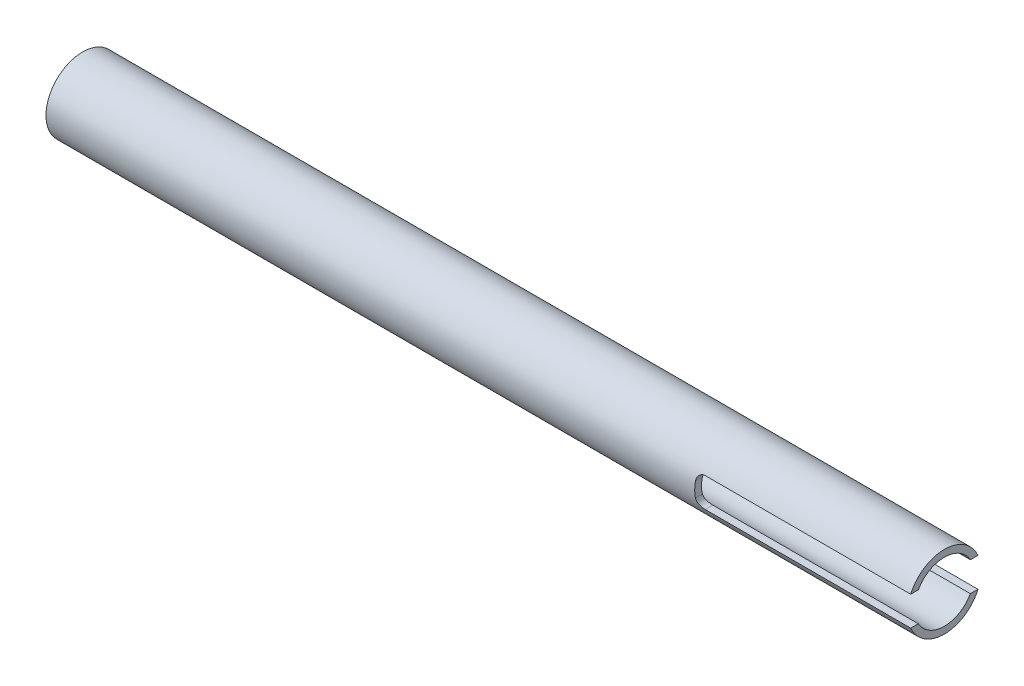
from build123d import *

# Parameters (mm, degrees)
BOSS_EXTRUDE1_DEPTH      = 98.610323
BOSS_EXTRUDE1_DEPTH_BACK = 87.674643
SKETCH1_R                = 7.9375
SKETCH1_R_2              = 6.4643
CUT_EXTRUDE1_DEPTH       = 101.194886763
FILLET1_R                = 1.5875


with BuildPart() as part:
    # Sketch1 → Boss-Extrude1 (new, two sides: drawn at the far end of the back side and taken through both)
    with BuildSketch(Plane(origin=(0, 0, 0), x_dir=(0, 0, -1), z_dir=(1, 0, 0)).offset(-BOSS_EXTRUDE1_DEPTH_BACK)):
        with Locations(Location((0, 0, 0), (0, 0, 180))):
            Circle(SKETCH1_R)
        with Locations(Location((0, 0, 0), (0, 0, 180))):
            Circle(SKETCH1_R_2, mode=Mode.SUBTRACT)
    extrude(amount=BOSS_EXTRUDE1_DEPTH + BOSS_EXTRUDE1_DEPTH_BACK)

    # Sketch2 → Cut-Extrude1 (cut, through all)
    with BuildSketch(Plane(origin=(0, 0, -7.9375), x_dir=(-1, 0, 0), z_dir=(0, 0, -1))):
        Polygon((-55.74782316, -3.175), (-54.16032316, -3.175), (-52.57282316, -3.175), (-52.57282316, 3.175), (-54.16032316, 3.175), (-55.74782316, 3.175), (-106.86532316, 3.175), (-106.86532316, -3.175), align=None)
    extrude(amount=-CUT_EXTRUDE1_DEPTH, mode=Mode.SUBTRACT)

    # Fillet1
    fillet1_edges = [part.edges().sort_by_distance(p)[0] for p in [
        (52.57282316, 3.175, -6.452847911),
        (52.57282316, 3.175, 6.452847911),
        (52.57282316, -3.175, -6.452847911),
        (52.57282316, -3.175, 6.452847911),
    ]]
    fillet(fillet1_edges, radius=FILLET1_R)


solid = part.part
